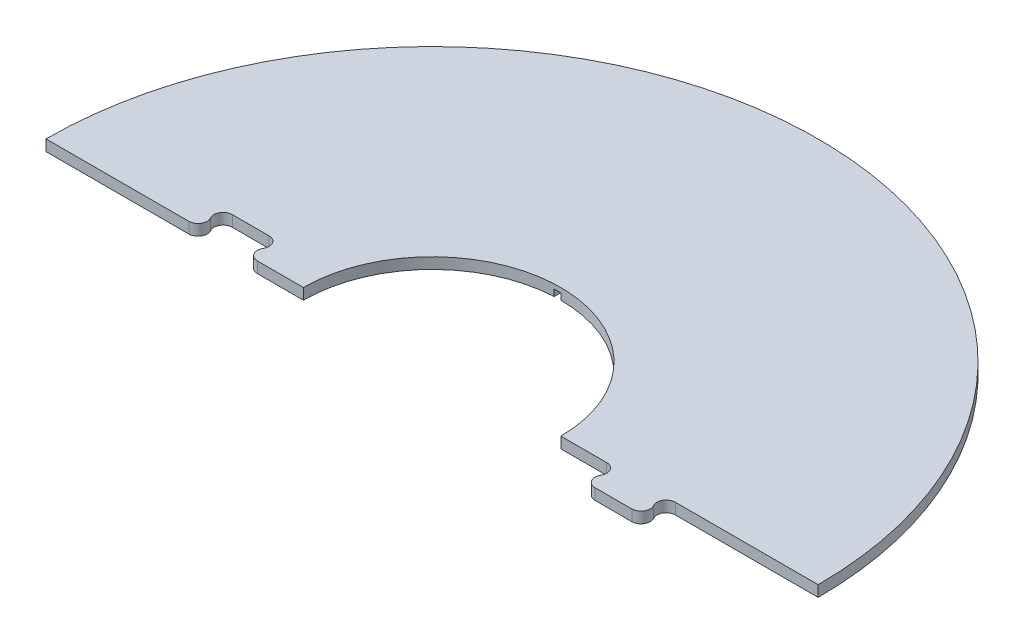
from build123d import *

# Parameters (mm, degrees)
BOSS_EXTRUDE1_DEPTH = 12
CUT_EXTRUDE1_DEPTH  = 7


with BuildPart() as part:
    # Sketch1 → Boss-Extrude1 (new body)
    with BuildSketch(Plane(origin=(0, 0, 0), x_dir=(1, 0, 0), z_dir=(0, 1, 0))):
        with BuildLine():
            Line((-420, 0), (-264.641016151, 0))
            ThreePointArc((-264.641016151, 0), (-255.980762114, 5), (-255.980762114, 15))
            ThreePointArc((-255.980762114, 15), (-255.980762114, 25), (-247.320508076, 30))
            Line((-247.320508076, 30), (-207.320508076, 30))
            ThreePointArc((-207.320508076, 30), (-198.660254038, 25), (-198.660254038, 15))
            ThreePointArc((-198.660254038, 15), (-198.660254038, 5), (-190, 0))
            Line((-190, 0), (-140, 0))
            ThreePointArc((-140, 0), (1.07e-06, 140), (140, -2.139e-06))
            Line((140, -2.139e-06), (190, -2.149e-06))
            ThreePointArc((190, -2.149e-06), (198.660254037, -5.000002151), (198.660254035, -15.000002151))
            ThreePointArc((198.660254035, -15.000002151), (198.660254033, -25.000002151), (207.32050807, -30.000002153))
            Line((207.32050807, -30.000002153), (247.32050807, -30.000002161))
            ThreePointArc((247.32050807, -30.000002161), (255.980762108, -25.000002163), (255.98076211, -15.000002163))
            ThreePointArc((255.98076211, -15.000002163), (255.980762113, -5.000002163), (264.641016151, -2.165e-06))
            Line((264.641016151, -2.165e-06), (420, -2.196e-06))
            ThreePointArc((420, -2.196e-06), (1.098e-06, 420), (-420, 0))
        make_face()
    extrude(amount=BOSS_EXTRUDE1_DEPTH)

    # Sketch2 → Cut-Extrude1 (cut)
    with BuildSketch(Plane.XZ):
        with BuildLine():
            ThreePointArc((0, -140), (-3.501094948, -139.956215775), (-7, -139.824890488))
            Line((-7, -139.824890488), (-7, -419.941662615))
            ThreePointArc((-7, -419.941662615), (-3.500121543, -419.985415401), (0, -420))
            Line((0, -420), (0, -140))
        make_face()
    extrude(amount=-CUT_EXTRUDE1_DEPTH, mode=Mode.SUBTRACT)


solid = part.part
